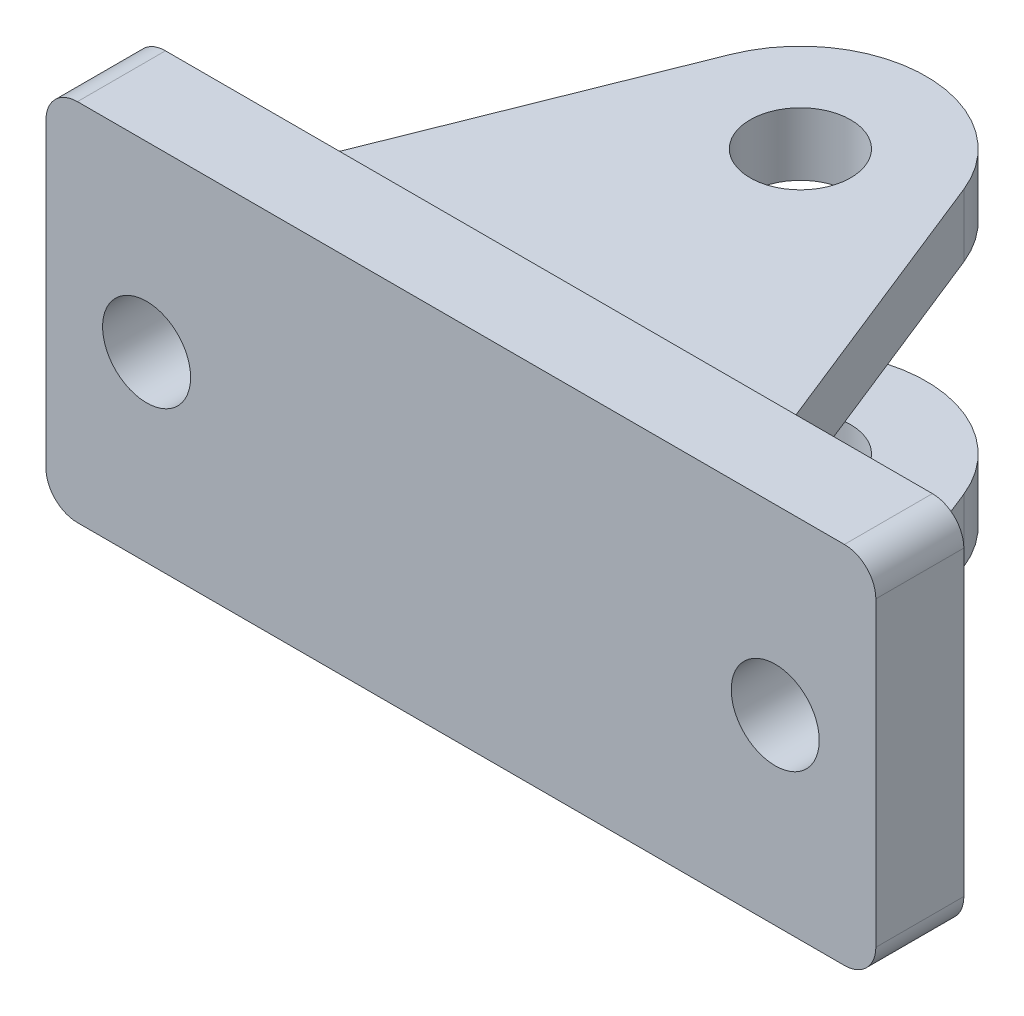
from build123d import *

# Parameters (mm, degrees)
SKETCH1_W            = 132
SKETCH1_H            = 58
SKETCH1_R            = 7
BOSS_EXTRUDE1_DEPTH  = 14
FILLET1_R            = 5
SKETCH2_R            = 8
BOSS_EXTRUDE2_DEPTH  = 10
FILLET2_R            = 5
FILLET2_OF_MIRROR1_R = 5


with BuildPart() as part:
    # Sketch1 → Boss-Extrude1 (new body)
    with BuildSketch(Plane.XY):
        Rectangle(SKETCH1_W, SKETCH1_H)
        with Locations((-50, 0)):
            Circle(SKETCH1_R, mode=Mode.SUBTRACT)
        with Locations((50, 0)):
            Circle(SKETCH1_R, mode=Mode.SUBTRACT)
    extrude(amount=BOSS_EXTRUDE1_DEPTH)

    # Fillet1
    fillet1_edges = [part.edges().sort_by_distance(p)[0] for p in [
        (66, -29, 7),
        (-66, -29, 7),
        (-66, 29, 7),
        (66, 29, 7),
    ]]
    fillet(fillet1_edges, radius=FILLET1_R)

    # Sketch2 → Boss-Extrude2 (add)
    with BuildSketch(Plane(origin=(0, -26, 0), x_dir=(-1, 0, 0), z_dir=(0, -1, 0))):
        with BuildLine():
            Line((-37.5, 0), (-18.575020612, 47.414081823))
            ThreePointArc((-18.575020612, 47.414081823), (0, 60), (18.575020612, 47.414081823))
            Line((18.575020612, 47.414081823), (37.5, 0))
            Line((37.5, 0), (-37.5, 0))
        make_face()
        with Locations(Location((0, 40, 0), (0, 0, 90))):
            Circle(SKETCH2_R, mode=Mode.SUBTRACT)
    boss_extrude2 = extrude(amount=-BOSS_EXTRUDE2_DEPTH)

    # Fillet2
    fillet2_edges = [part.edges().sort_by_distance(p)[0] for p in [
        (-37.5, -21, 0),
        (37.5, -21, 0),
    ]]
    fillet(fillet2_edges, radius=FILLET2_R)

    # Mirror1: Boss-Extrude2 across plane
    add(boss_extrude2.mirror(Plane.ZX))

    # Fillet2 of Mirror1
    fillet2_of_mirror1_edges = [part.edges().sort_by_distance(p)[0] for p in [
        (-37.5, 21, 0),
        (37.5, 21, 0),
    ]]
    fillet(fillet2_of_mirror1_edges, radius=FILLET2_OF_MIRROR1_R)


solid = part.part
